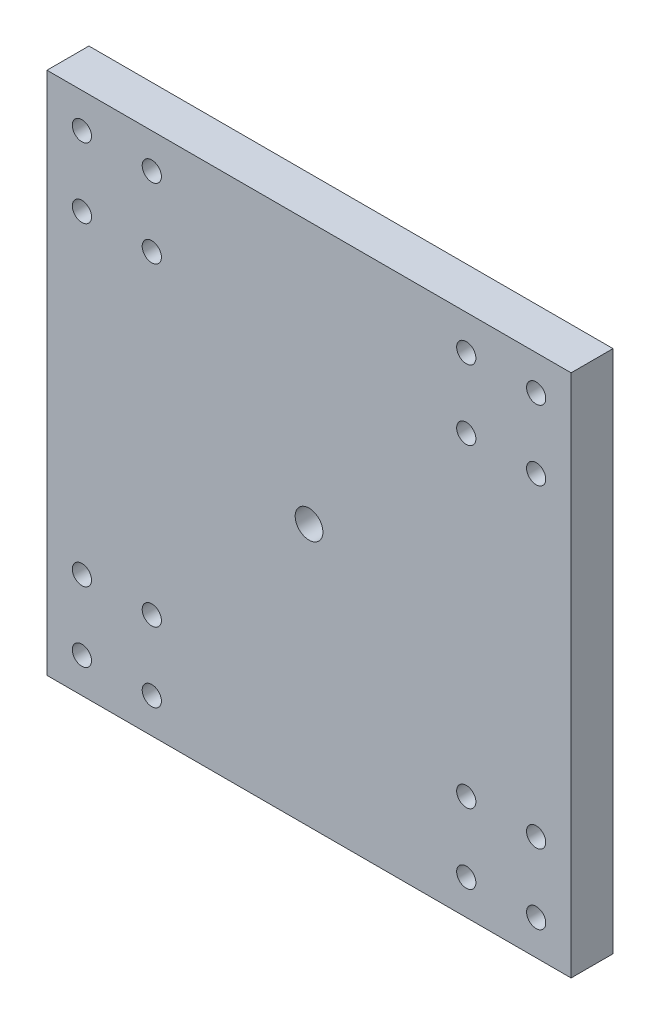
from build123d import *

# Parameters (mm, degrees)
SKETCH1_W                                           = 150
SKETCH1_H                                           = 150
BOSS_EXTRUDE1_DEPTH                                 = 12
F_3_8_16_TAPPED_HOLE1_D                             = 7.9375
CBORE_FOR_M5_HEX_SOCKET_HEAD_CAP_SCREW1_D           = 5.5
CBORE_FOR_M5_HEX_SOCKET_HEAD_CAP_SCREW1_CBORE_D     = 10
CBORE_FOR_M5_HEX_SOCKET_HEAD_CAP_SCREW1_CBORE_DEPTH = 5.5


with BuildPart() as part:
    # Sketch1 → Boss-Extrude1 (new body)
    with BuildSketch(Plane.XY):
        Rectangle(SKETCH1_W, SKETCH1_H)
    extrude(amount=BOSS_EXTRUDE1_DEPTH)

    # 3/8-16 Tapped Hole1 (through all)
    with Locations(Plane.XY.offset(12)):
        with Locations((0, 0)):
            Hole(F_3_8_16_TAPPED_HOLE1_D / 2)

    # CBORE for M5 Hex Socket Head Cap Screw1 (through all)
    with Locations(Plane(origin=(0, 0, 0), x_dir=(1, 0, 0), z_dir=(0, 0, -1))):
        with Locations((-65, -65), (-45, -65), (-65, -45), (-65, 45), (-45, 65), (-65, 65), (65, 45), (65, 65), (45, 65), (45, -65), (65, -65), (65, -45), (-45, -45), (45, -45), (45, 45), (-45, 45)):
            CounterBoreHole(CBORE_FOR_M5_HEX_SOCKET_HEAD_CAP_SCREW1_D / 2, CBORE_FOR_M5_HEX_SOCKET_HEAD_CAP_SCREW1_CBORE_D / 2, CBORE_FOR_M5_HEX_SOCKET_HEAD_CAP_SCREW1_CBORE_DEPTH)


solid = part.part
